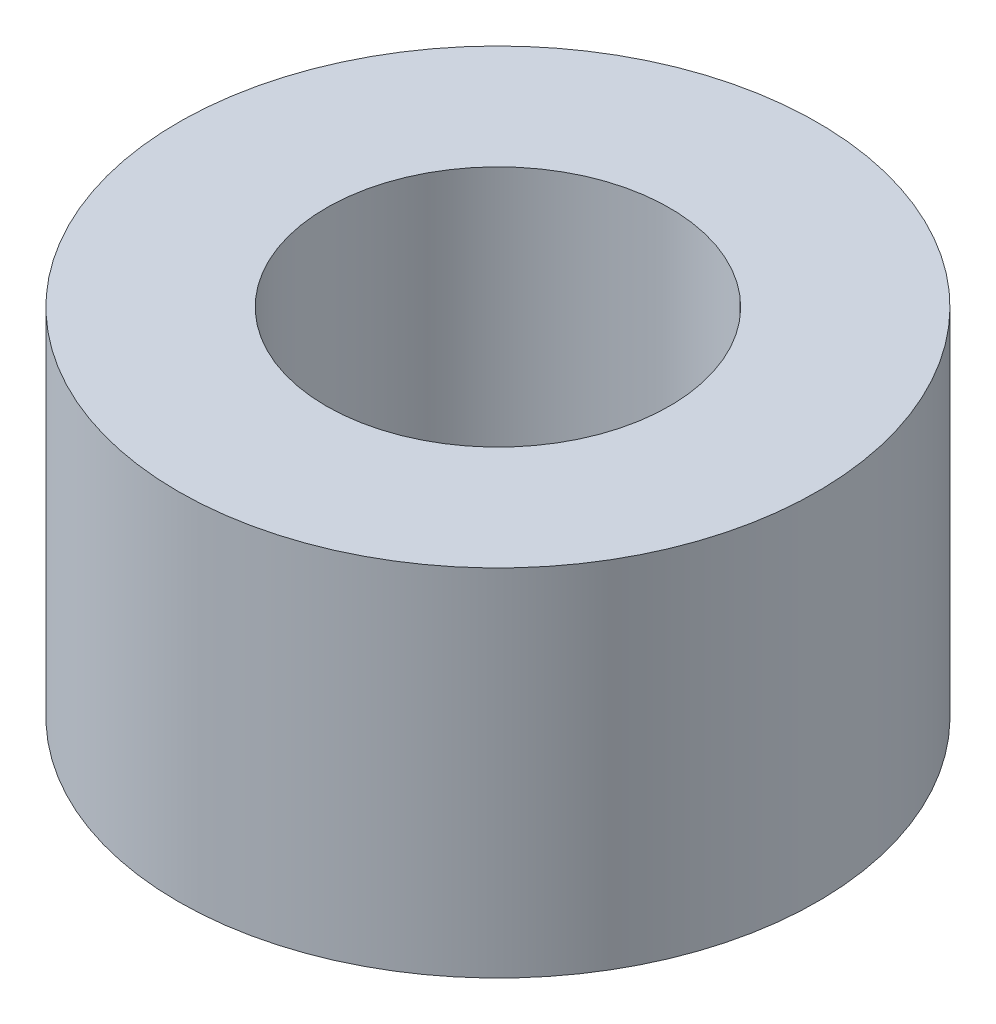
from build123d import *

# Parameters (mm, degrees)
SKETCH1_R           = 27
SKETCH1_R_2         = 14.5
BOSS_EXTRUDE1_DEPTH = 30


with BuildPart() as part:
    # Sketch1 → Boss-Extrude1 (new body)
    with BuildSketch(Plane(origin=(0, 0, 0), x_dir=(1, 0, 0), z_dir=(0, 1, 0))):
        with Locations(Location((0, 0, 0), (0, 0, 270))):
            Circle(SKETCH1_R)
        with Locations(Location((0, 0, 0), (0, 0, 270))):
            Circle(SKETCH1_R_2, mode=Mode.SUBTRACT)
    extrude(amount=BOSS_EXTRUDE1_DEPTH)


solid = part.part
